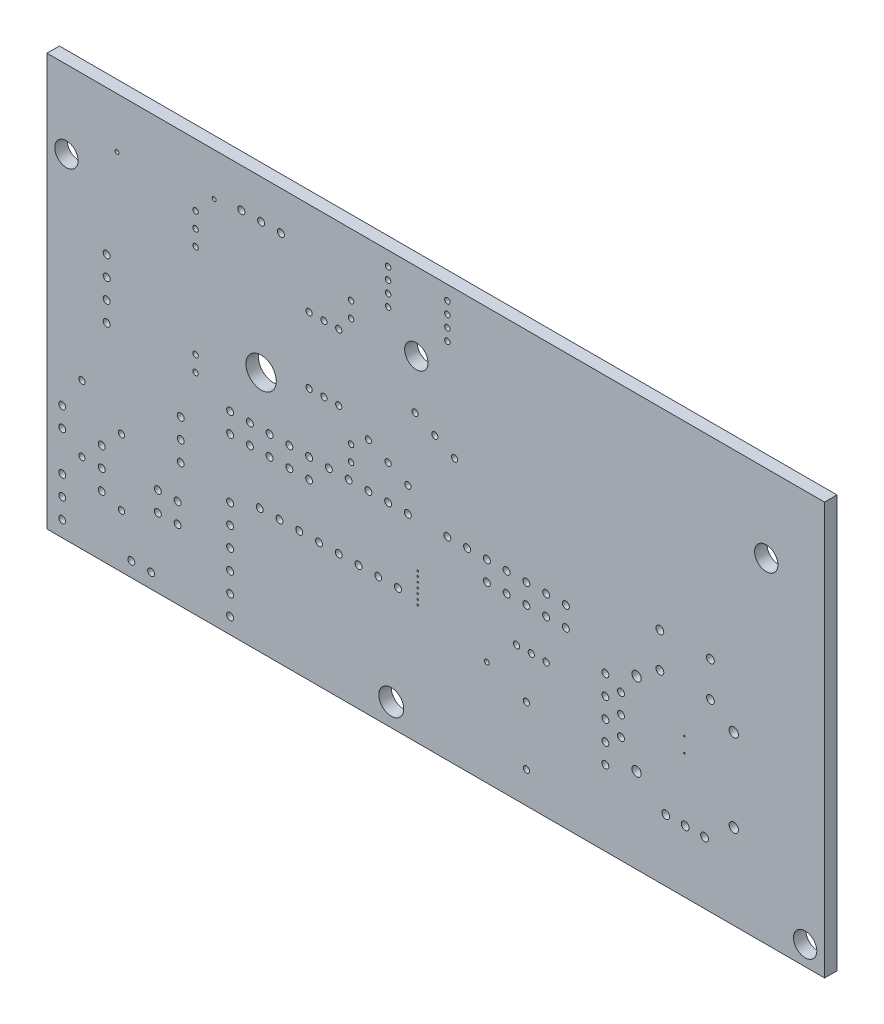
from build123d import *

# Parameters (mm, degrees)
MODEL_W             = 100
MODEL_H             = 53
MODEL_R             = 0.305
MODEL_R_2           = 0.25
MODEL_R_3           = 0.4445
MODEL_R_4           = 0.4
MODEL_R_5           = 1.95
MODEL_R_6           = 0.45
MODEL_R_7           = 1.6
MODEL_R_8           = 0.35
MODEL_R_9           = 0.4065
MODEL_R_10          = 0.5
MODEL_R_11          = 0.6
MODEL_R_12          = 1.5
MODEL_R_13          = 0.1
BOSS_EXTRUDE1_DEPTH = 1.6


with BuildPart() as part:
    # Model → Boss-Extrude1 (new body)
    with BuildSketch(Plane.XY):
        with Locations((490, 471.5)):
            Rectangle(MODEL_W, MODEL_H)
        with Locations((496.57, 458.47)):
            Circle(MODEL_R, mode=Mode.SUBTRACT)
        with Locations((461.5, 492.5)):
            Circle(MODEL_R_2, mode=Mode.SUBTRACT)
        with Locations((449, 491.5)):
            Circle(MODEL_R_2, mode=Mode.SUBTRACT)
        with Locations((453.39, 446.886)):
            Circle(MODEL_R_3, mode=Mode.SUBTRACT)
        with Locations((450.85, 446.886)):
            Circle(MODEL_R_3, mode=Mode.SUBTRACT)
        with Locations((457.2, 461.01)):
            Circle(MODEL_R_3, mode=Mode.SUBTRACT)
        with Locations((457.2, 463.55)):
            Circle(MODEL_R_3, mode=Mode.SUBTRACT)
        with Locations((457.2, 466.09)):
            Circle(MODEL_R_3, mode=Mode.SUBTRACT)
        with Locations((447.675, 479.425)):
            Circle(MODEL_R_3, mode=Mode.SUBTRACT)
        with Locations((447.675, 476.885)):
            Circle(MODEL_R_3, mode=Mode.SUBTRACT)
        with Locations((447.675, 474.345)):
            Circle(MODEL_R_3, mode=Mode.SUBTRACT)
        with Locations((447.675, 471.805)):
            Circle(MODEL_R_3, mode=Mode.SUBTRACT)
        with Locations((447.04, 457.835)):
            Circle(MODEL_R_3, mode=Mode.SUBTRACT)
        with Locations((447.04, 455.295)):
            Circle(MODEL_R_3, mode=Mode.SUBTRACT)
        with Locations((447.04, 452.755)):
            Circle(MODEL_R_3, mode=Mode.SUBTRACT)
        with Locations((441.96, 459.74)):
            Circle(MODEL_R_3, mode=Mode.SUBTRACT)
        with Locations((441.96, 457.2)):
            Circle(MODEL_R_3, mode=Mode.SUBTRACT)
        with Locations((449.58, 451.875)):
            Circle(MODEL_R_4, mode=Mode.SUBTRACT)
        with Locations((449.58, 460.375)):
            Circle(MODEL_R_4, mode=Mode.SUBTRACT)
        with Locations((444.5, 463.795)):
            Circle(MODEL_R_4, mode=Mode.SUBTRACT)
        with Locations((444.5, 455.295)):
            Circle(MODEL_R_4, mode=Mode.SUBTRACT)
        with Locations((494.03, 469.9)):
            Circle(MODEL_R_3, mode=Mode.SUBTRACT)
        with Locations((491.49, 469.9)):
            Circle(MODEL_R_3, mode=Mode.SUBTRACT)
        with Locations((496.57, 467.36)):
            Circle(MODEL_R_3, mode=Mode.SUBTRACT)
        with Locations((496.57, 469.9)):
            Circle(MODEL_R_3, mode=Mode.SUBTRACT)
        with Locations((467.54, 476.2)):
            Circle(MODEL_R_5, mode=Mode.SUBTRACT)
        with Locations((470.08, 493)):
            Circle(MODEL_R_6, mode=Mode.SUBTRACT)
        with Locations((467.54, 493)):
            Circle(MODEL_R_6, mode=Mode.SUBTRACT)
        with Locations((465, 493)):
            Circle(MODEL_R_6, mode=Mode.SUBTRACT)
        with Locations((456.797, 453.94)):
            Circle(MODEL_R_3, mode=Mode.SUBTRACT)
        with Locations((454.257, 453.94)):
            Circle(MODEL_R_3, mode=Mode.SUBTRACT)
        with Locations((454.257, 456.48)):
            Circle(MODEL_R_3, mode=Mode.SUBTRACT)
        with Locations((456.797, 456.48)):
            Circle(MODEL_R_3, mode=Mode.SUBTRACT)
        with Locations((441.96, 447.04)):
            Circle(MODEL_R_3, mode=Mode.SUBTRACT)
        with Locations((441.96, 449.58)):
            Circle(MODEL_R_3, mode=Mode.SUBTRACT)
        with Locations((441.96, 452.12)):
            Circle(MODEL_R_3, mode=Mode.SUBTRACT)
        with Locations((484.27, 447.89)):
            Circle(MODEL_R_7, mode=Mode.SUBTRACT)
        with Locations((485.14, 461.01)):
            Circle(MODEL_R_3, mode=Mode.SUBTRACT)
        with Locations((482.6, 461.01)):
            Circle(MODEL_R_3, mode=Mode.SUBTRACT)
        with Locations((480.06, 461.01)):
            Circle(MODEL_R_3, mode=Mode.SUBTRACT)
        with Locations((477.52, 461.01)):
            Circle(MODEL_R_3, mode=Mode.SUBTRACT)
        with Locations((474.98, 461.01)):
            Circle(MODEL_R_3, mode=Mode.SUBTRACT)
        with Locations((472.44, 461.01)):
            Circle(MODEL_R_3, mode=Mode.SUBTRACT)
        with Locations((469.9, 461.01)):
            Circle(MODEL_R_3, mode=Mode.SUBTRACT)
        with Locations((467.36, 461.01)):
            Circle(MODEL_R_3, mode=Mode.SUBTRACT)
        with Locations((473.71, 486.02)):
            Circle(MODEL_R_4, mode=Mode.SUBTRACT)
        with Locations((473.71, 477.52)):
            Circle(MODEL_R_4, mode=Mode.SUBTRACT)
        with Locations((492.42, 479.085)):
            Circle(MODEL_R_4, mode=Mode.SUBTRACT)
        with Locations((486.41, 473.075)):
            Circle(MODEL_R_4, mode=Mode.SUBTRACT)
        with Locations((489.88, 480.355)):
            Circle(MODEL_R_4, mode=Mode.SUBTRACT)
        with Locations((483.87, 474.345)):
            Circle(MODEL_R_4, mode=Mode.SUBTRACT)
        with Locations((475.615, 486.02)):
            Circle(MODEL_R_4, mode=Mode.SUBTRACT)
        with Locations((475.615, 477.52)):
            Circle(MODEL_R_4, mode=Mode.SUBTRACT)
        with Locations((477.52, 486.02)):
            Circle(MODEL_R_4, mode=Mode.SUBTRACT)
        with Locations((477.52, 477.52)):
            Circle(MODEL_R_4, mode=Mode.SUBTRACT)
        with Locations((487.34, 481.625)):
            Circle(MODEL_R_4, mode=Mode.SUBTRACT)
        with Locations((481.33, 475.615)):
            Circle(MODEL_R_4, mode=Mode.SUBTRACT)
        with Locations((491.49, 496.165)):
            Circle(MODEL_R_8, mode=Mode.SUBTRACT)
        with Locations((491.49, 494.665)):
            Circle(MODEL_R_8, mode=Mode.SUBTRACT)
        with Locations((491.49, 493.165)):
            Circle(MODEL_R_8, mode=Mode.SUBTRACT)
        with Locations((491.49, 491.665)):
            Circle(MODEL_R_8, mode=Mode.SUBTRACT)
        with Locations((483.87, 496.165)):
            Circle(MODEL_R_8, mode=Mode.SUBTRACT)
        with Locations((483.87, 494.665)):
            Circle(MODEL_R_8, mode=Mode.SUBTRACT)
        with Locations((483.87, 493.165)):
            Circle(MODEL_R_8, mode=Mode.SUBTRACT)
        with Locations((483.87, 491.665)):
            Circle(MODEL_R_8, mode=Mode.SUBTRACT)
        with Locations((459.105, 488)):
            Circle(MODEL_R_8, mode=Mode.SUBTRACT)
        with Locations((459.105, 486)):
            Circle(MODEL_R_8, mode=Mode.SUBTRACT)
        with Locations((459.105, 490)):
            Circle(MODEL_R_8, mode=Mode.SUBTRACT)
        with Locations((479.105, 488)):
            Circle(MODEL_R_8, mode=Mode.SUBTRACT)
        with Locations((479.105, 490)):
            Circle(MODEL_R_8, mode=Mode.SUBTRACT)
        with Locations((479.105, 472)):
            Circle(MODEL_R_8, mode=Mode.SUBTRACT)
        with Locations((479.105, 474)):
            Circle(MODEL_R_8, mode=Mode.SUBTRACT)
        with Locations((459.105, 474)):
            Circle(MODEL_R_8, mode=Mode.SUBTRACT)
        with Locations((459.105, 472)):
            Circle(MODEL_R_8, mode=Mode.SUBTRACT)
        with Locations((501.65, 449.065)):
            Circle(MODEL_R_4, mode=Mode.SUBTRACT)
        with Locations((501.65, 456.565)):
            Circle(MODEL_R_4, mode=Mode.SUBTRACT)
        with Locations((500.38, 462.28)):
            Circle(MODEL_R_9, mode=Mode.SUBTRACT)
        with Locations((502.285, 462.28)):
            Circle(MODEL_R_9, mode=Mode.SUBTRACT)
        with Locations((504.19, 462.28)):
            Circle(MODEL_R_9, mode=Mode.SUBTRACT)
        with Locations((518.82, 473.18)):
            Circle(MODEL_R_10, mode=Mode.SUBTRACT)
        with Locations((525.32, 473.18)):
            Circle(MODEL_R_10, mode=Mode.SUBTRACT)
        with Locations((525.32, 468.68)):
            Circle(MODEL_R_10, mode=Mode.SUBTRACT)
        with Locations((518.82, 468.68)):
            Circle(MODEL_R_10, mode=Mode.SUBTRACT)
        with Locations((513.82, 463.73)):
            Circle(MODEL_R_3, mode=Mode.SUBTRACT)
        with Locations((513.82, 461.23)):
            Circle(MODEL_R_3, mode=Mode.SUBTRACT)
        with Locations((513.82, 458.73)):
            Circle(MODEL_R_3, mode=Mode.SUBTRACT)
        with Locations((528.32, 466.53)):
            Circle(MODEL_R_11, mode=Mode.SUBTRACT)
        with Locations((515.82, 466.53)):
            Circle(MODEL_R_11, mode=Mode.SUBTRACT)
        with Locations((515.82, 455.93)):
            Circle(MODEL_R_11, mode=Mode.SUBTRACT)
        with Locations((528.32, 455.93)):
            Circle(MODEL_R_11, mode=Mode.SUBTRACT)
        with Locations((519.57, 452.98)):
            Circle(MODEL_R_10, mode=Mode.SUBTRACT)
        with Locations((522.07, 452.98)):
            Circle(MODEL_R_10, mode=Mode.SUBTRACT)
        with Locations((524.57, 452.98)):
            Circle(MODEL_R_10, mode=Mode.SUBTRACT)
        with Locations((511.81, 457.2)):
            Circle(MODEL_R_3, mode=Mode.SUBTRACT)
        with Locations((511.81, 459.74)):
            Circle(MODEL_R_3, mode=Mode.SUBTRACT)
        with Locations((511.81, 462.28)):
            Circle(MODEL_R_3, mode=Mode.SUBTRACT)
        with Locations((511.81, 464.82)):
            Circle(MODEL_R_3, mode=Mode.SUBTRACT)
        with Locations((463.55, 447.04)):
            Circle(MODEL_R_3, mode=Mode.SUBTRACT)
        with Locations((463.55, 449.58)):
            Circle(MODEL_R_3, mode=Mode.SUBTRACT)
        with Locations((463.55, 452.12)):
            Circle(MODEL_R_3, mode=Mode.SUBTRACT)
        with Locations((463.55, 454.66)):
            Circle(MODEL_R_3, mode=Mode.SUBTRACT)
        with Locations((463.55, 457.2)):
            Circle(MODEL_R_3, mode=Mode.SUBTRACT)
        with Locations((463.55, 459.74)):
            Circle(MODEL_R_3, mode=Mode.SUBTRACT)
        with Locations((506.73, 467.36)):
            Circle(MODEL_R_3, mode=Mode.SUBTRACT)
        with Locations((504.19, 467.36)):
            Circle(MODEL_R_3, mode=Mode.SUBTRACT)
        with Locations((501.65, 467.36)):
            Circle(MODEL_R_3, mode=Mode.SUBTRACT)
        with Locations((499.11, 467.36)):
            Circle(MODEL_R_3, mode=Mode.SUBTRACT)
        with Locations((506.73, 469.9)):
            Circle(MODEL_R_3, mode=Mode.SUBTRACT)
        with Locations((504.19, 469.9)):
            Circle(MODEL_R_3, mode=Mode.SUBTRACT)
        with Locations((501.65, 469.9)):
            Circle(MODEL_R_3, mode=Mode.SUBTRACT)
        with Locations((499.11, 469.9)):
            Circle(MODEL_R_3, mode=Mode.SUBTRACT)
        with Locations((486.41, 469.9)):
            Circle(MODEL_R_3, mode=Mode.SUBTRACT)
        with Locations((483.87, 469.9)):
            Circle(MODEL_R_3, mode=Mode.SUBTRACT)
        with Locations((481.33, 469.9)):
            Circle(MODEL_R_3, mode=Mode.SUBTRACT)
        with Locations((478.79, 469.9)):
            Circle(MODEL_R_3, mode=Mode.SUBTRACT)
        with Locations((476.25, 469.9)):
            Circle(MODEL_R_3, mode=Mode.SUBTRACT)
        with Locations((473.71, 467.36)):
            Circle(MODEL_R_3, mode=Mode.SUBTRACT)
        with Locations((471.17, 467.36)):
            Circle(MODEL_R_3, mode=Mode.SUBTRACT)
        with Locations((468.63, 467.36)):
            Circle(MODEL_R_3, mode=Mode.SUBTRACT)
        with Locations((466.09, 467.36)):
            Circle(MODEL_R_3, mode=Mode.SUBTRACT)
        with Locations((463.55, 467.36)):
            Circle(MODEL_R_3, mode=Mode.SUBTRACT)
        with Locations((473.71, 469.9)):
            Circle(MODEL_R_3, mode=Mode.SUBTRACT)
        with Locations((471.17, 469.9)):
            Circle(MODEL_R_3, mode=Mode.SUBTRACT)
        with Locations((468.63, 469.9)):
            Circle(MODEL_R_3, mode=Mode.SUBTRACT)
        with Locations((466.09, 469.9)):
            Circle(MODEL_R_3, mode=Mode.SUBTRACT)
        with Locations((463.55, 469.9)):
            Circle(MODEL_R_3, mode=Mode.SUBTRACT)
        with Locations((487.5, 488)):
            Circle(MODEL_R_12, mode=Mode.SUBTRACT)
        with Locations((442.5, 488)):
            Circle(MODEL_R_12, mode=Mode.SUBTRACT)
        with Locations((532.5, 488)):
            Circle(MODEL_R_12, mode=Mode.SUBTRACT)
        with Locations((537.5, 447.5)):
            Circle(MODEL_R_12, mode=Mode.SUBTRACT)
        with Locations((511.81, 454.66)):
            Circle(MODEL_R_3, mode=Mode.SUBTRACT)
        with Locations((521.97, 461.01)):
            Circle(MODEL_R_13, mode=Mode.SUBTRACT)
        with Locations((521.97, 462.915)):
            Circle(MODEL_R_13, mode=Mode.SUBTRACT)
        with Locations((487.68, 464.185)):
            Circle(MODEL_R_13, mode=Mode.SUBTRACT)
        with Locations((487.68, 463.55)):
            Circle(MODEL_R_13, mode=Mode.SUBTRACT)
        with Locations((487.68, 462.915)):
            Circle(MODEL_R_13, mode=Mode.SUBTRACT)
        with Locations((487.68, 462.28)):
            Circle(MODEL_R_13, mode=Mode.SUBTRACT)
        with Locations((487.68, 461.01)):
            Circle(MODEL_R_13, mode=Mode.SUBTRACT)
        with Locations((487.68, 460.375)):
            Circle(MODEL_R_13, mode=Mode.SUBTRACT)
        with Locations((487.68, 461.645)):
            Circle(MODEL_R_13, mode=Mode.SUBTRACT)
    extrude(amount=BOSS_EXTRUDE1_DEPTH)


solid = part.part
